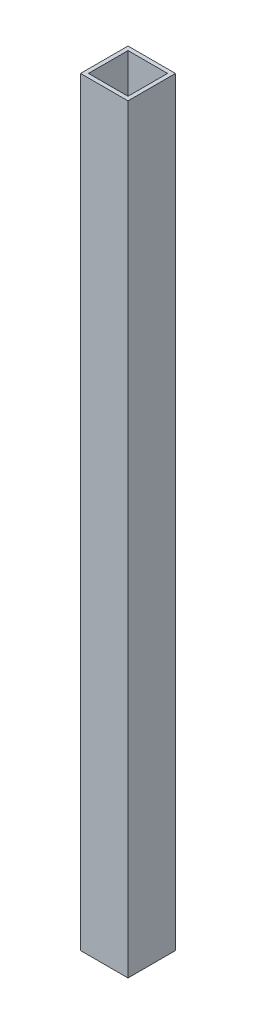
from build123d import *

# Parameters (mm, degrees)
SKETCH1_W           = 19.05
SKETCH1_H           = 19.05
SKETCH1_W_2         = 15.875
SKETCH1_H_2         = 15.875
BOSS_EXTRUDE1_DEPTH = 304.8


with BuildPart() as part:
    # Sketch1 → Boss-Extrude1 (new body)
    with BuildSketch(Plane(origin=(0, 0, 0), x_dir=(1, 0, 0), z_dir=(0, 1, 0))):
        Rectangle(SKETCH1_W, SKETCH1_H)
        Rectangle(SKETCH1_W_2, SKETCH1_H_2, mode=Mode.SUBTRACT)
    extrude(amount=BOSS_EXTRUDE1_DEPTH)


solid = part.part
